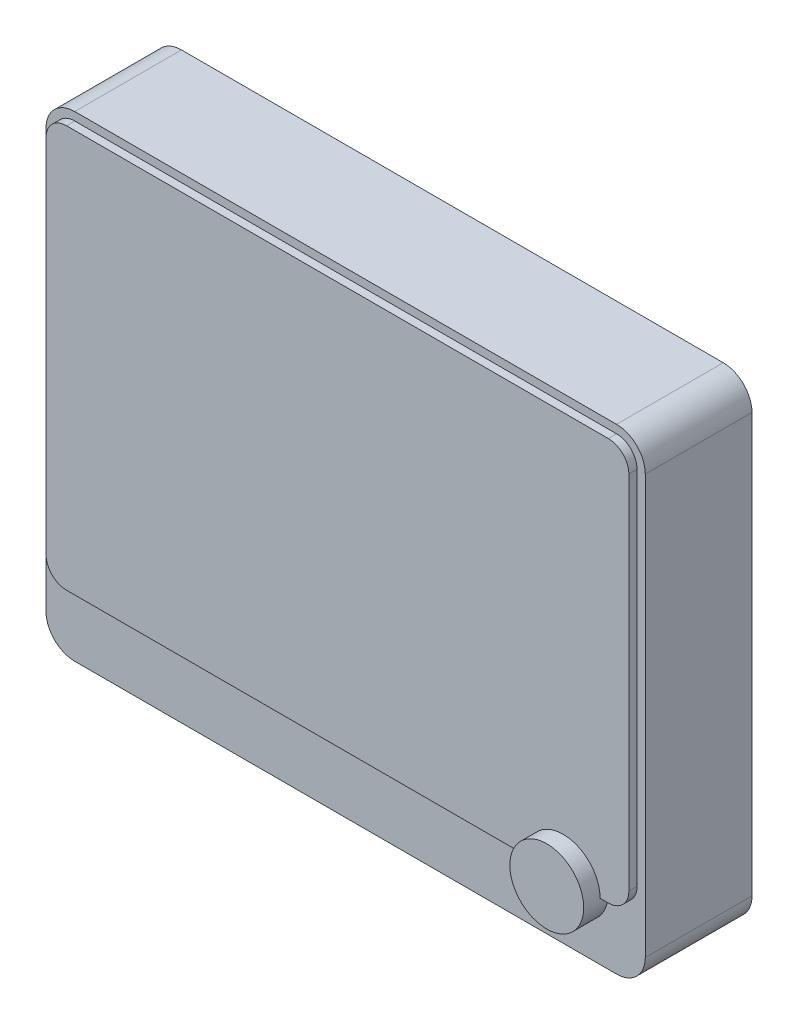
from build123d import *

# Parameters (mm, degrees)
SKETCH1_W           = 73
SKETCH1_H           = 58
BOSS_EXTRUDE1_DEPTH = 13
FILLET1_R           = 3.5
BOSS_EXTRUDE2_DEPTH = 1
SKETCH3_R           = 4.5
BOSS_EXTRUDE3_DEPTH = 3
SKETCH6_W           = 53
SKETCH6_H           = 6
CUT_EXTRUDE2_DEPTH  = 1


with BuildPart() as part:
    # Sketch1 → Boss-Extrude1 (new body)
    with BuildSketch(Plane.XY):
        with Locations((36.5, 29)):
            Rectangle(SKETCH1_W, SKETCH1_H)
    extrude(amount=BOSS_EXTRUDE1_DEPTH)

    # Fillet1
    fillet1_edges = [part.edges().sort_by_distance(p)[0] for p in [
        (0, 58, 6.5),
        (73, 58, 6.5),
        (73, 0, 6.5),
        (0, 0, 6.5),
    ]]
    fillet(fillet1_edges, radius=FILLET1_R)

    # Sketch2 → Boss-Extrude2 (add)
    with BuildSketch(Plane.XY.offset(13)):
        with BuildLine():
            Line((3.5, 8), (69.5, 8))
            ThreePointArc((69.5, 8), (71.267766953, 8.732233047), (72, 10.5))
            Line((72, 10.5), (72, 54.5))
            ThreePointArc((72, 54.5), (71.267766953, 56.267766953), (69.5, 57))
            Line((69.5, 57), (3.5, 57))
            ThreePointArc((3.5, 57), (1.732233047, 56.267766953), (1, 54.5))
            Line((1, 54.5), (1, 10.5))
            ThreePointArc((1, 10.5), (1.732233047, 8.732233047), (3.5, 8))
        make_face()
    extrude(amount=BOSS_EXTRUDE2_DEPTH)

    # Sketch3 → Boss-Extrude3 (add)
    with BuildSketch(Plane.XY.offset(13)):
        with Locations((64, 8)):
            Circle(SKETCH3_R)
    extrude(amount=BOSS_EXTRUDE3_DEPTH)

    # Sketch6 → Cut-Extrude2 (cut)
    with BuildSketch(Plane(origin=(0, 0, 0), x_dir=(-1, 0, 0), z_dir=(0, 0, -1))):
        with Locations((-36.5, 45)):
            Rectangle(SKETCH6_W, SKETCH6_H)
    extrude(amount=-CUT_EXTRUDE2_DEPTH, mode=Mode.SUBTRACT)


solid = part.part
